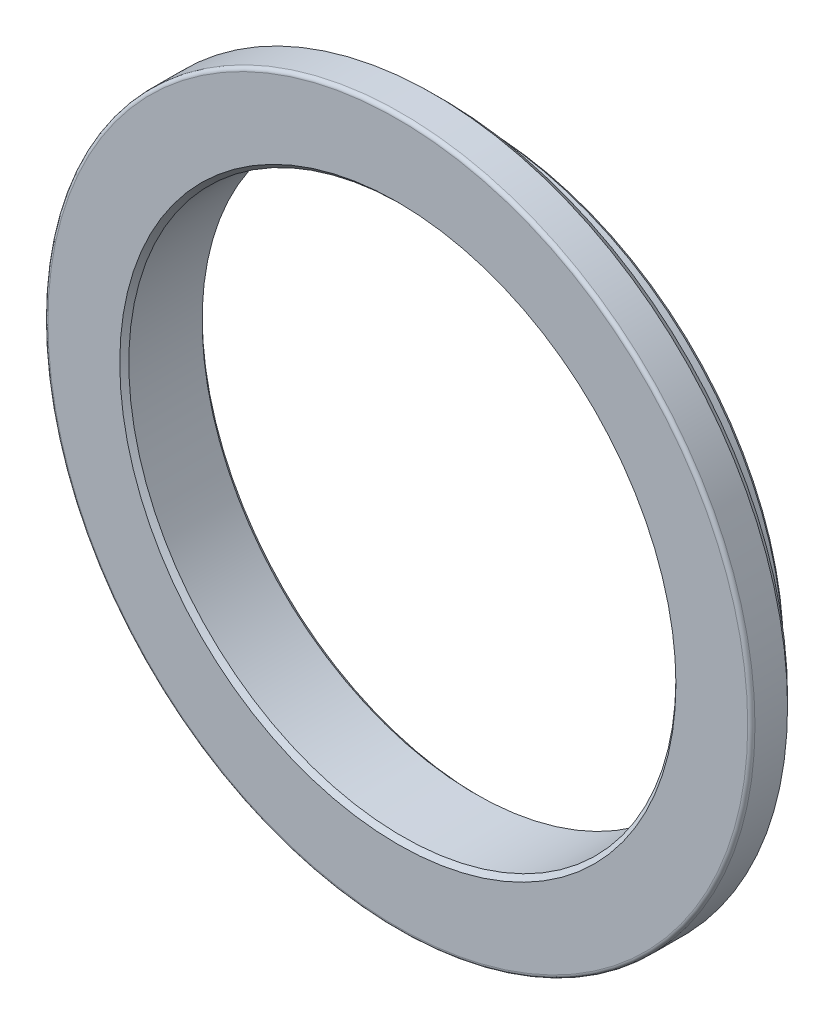
from build123d import *


with BuildPart() as part:
    # Sketch1 → Revolve1 (revolve)
    with BuildSketch(Plane(origin=(0, 0, 0), x_dir=(0, 0, -1), z_dir=(1, 0, 0)), mode=Mode.PRIVATE) as revolve1_sk:
        with BuildLine():
            Line((0, 30.725), (0.5, 30.225))
            Line((0.5, 30.225), (8.6, 30.225))
            Line((8.6, 30.225), (9.1, 30.725))
            Line((9.1, 30.725), (9.1, 33.5))
            Line((9.1, 33.5), (8.6, 34))
            Line((8.6, 34), (5.4, 34))
            ThreePointArc((5.4, 34), (5.117157288, 34.117157288), (5, 34.4))
            Line((5, 34.4), (5, 38.06))
            Line((5, 38.06), (4, 39.06))
            Line((4, 39.06), (0.4, 39.06))
            ThreePointArc((0.4, 39.06), (0.117157288, 38.942842712), (0, 38.66))
            Line((0, 38.66), (0, 30.725))
        make_face()
    revolve(revolve1_sk.sketch.rotate(Axis((0, 0, 0), (0, 0, -1)), 90), axis=Axis((0, 0, 0), (0, 0, -1)))


solid = part.part
